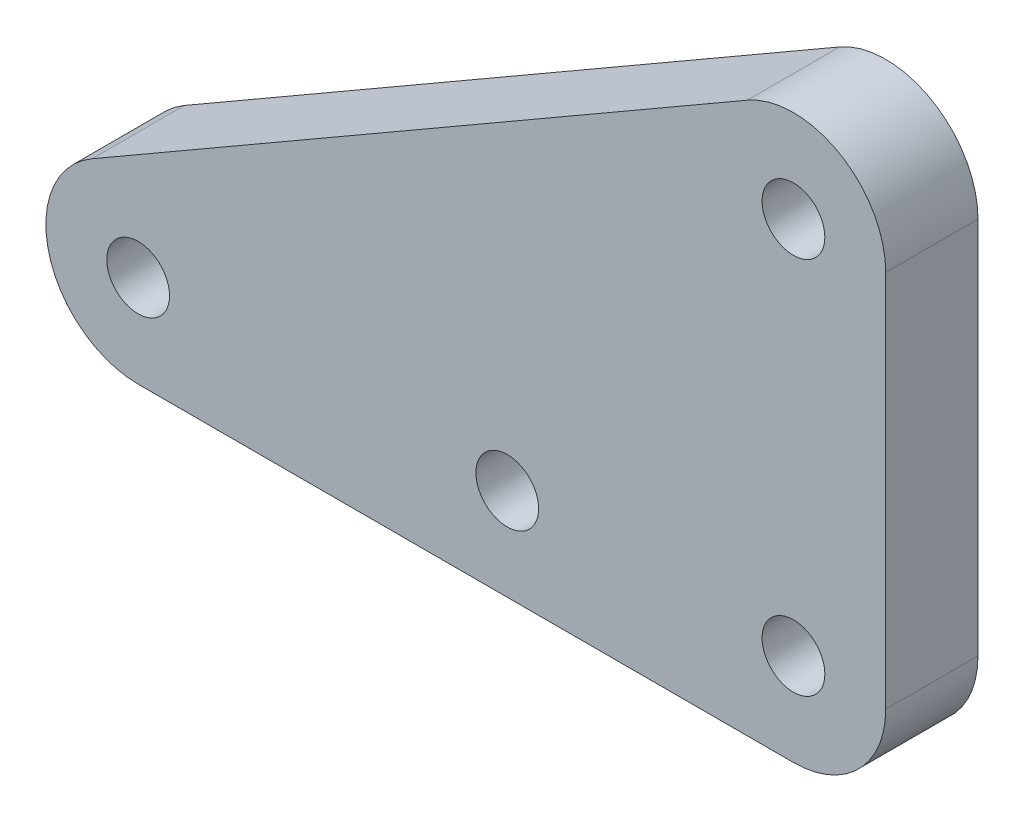
from build123d import *

# Parameters (mm, degrees)
SKETCH_1_R      = 1.7
EXTRUDE_1_DEPTH = 5


with BuildPart() as part:
    # ｽｹｯﾁ1 → ﾎﾞｽ - 押し出し1 (new body)
    with BuildSketch(Plane.XY):
        with BuildLine():
            ThreePointArc((35.507041555, -5), (39.042575461, -3.535533906), (40.507041555, 0))
            Line((40.507041555, 0), (40.507041555, 20.5))
            ThreePointArc((40.507041555, 20.5), (38.007041622, 24.830126981), (33.007041688, 24.830127096))
            Line((33.007041688, 24.830127096), (-2.50000007, 4.330126978))
            ThreePointArc((-2.50000007, 4.330126978), (-4.829629126, -1.294095246), (-3.8e-08, -5))
            Line((-3.8e-08, -5), (35.507041555, -5))
        make_face()
        Circle(SKETCH_1_R, mode=Mode.SUBTRACT)
        with Locations((20, 0)):
            Circle(SKETCH_1_R, mode=Mode.SUBTRACT)
        with Locations((35.507041555, 0)):
            Circle(SKETCH_1_R, mode=Mode.SUBTRACT)
        with Locations((35.507041555, 20.5)):
            Circle(SKETCH_1_R, mode=Mode.SUBTRACT)
    extrude(amount=EXTRUDE_1_DEPTH)


solid = part.part
